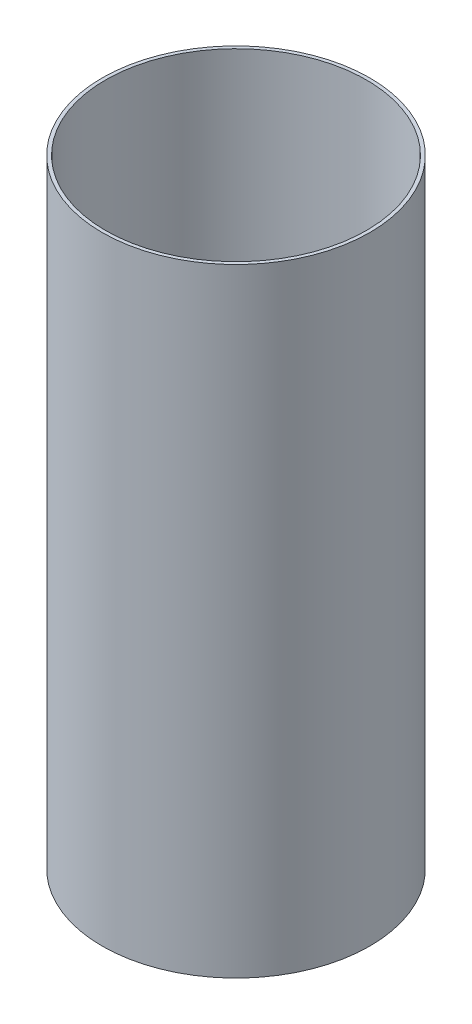
from build123d import *

# Parameters (mm, degrees)
SKETCH1_R           = 49.53
SKETCH1_R_2         = 48.26
BOSS_EXTRUDE1_DEPTH = 228.6


with BuildPart() as part:
    # Sketch1 → Boss-Extrude1 (new body)
    with BuildSketch(Plane(origin=(0, 0, 0), x_dir=(1, 0, 0), z_dir=(0, 1, 0))):
        with Locations(Location((0, 0, 0), (0, 0, 270))):
            Circle(SKETCH1_R)
        with Locations(Location((0, 0, 0), (0, 0, 270))):
            Circle(SKETCH1_R_2, mode=Mode.SUBTRACT)
    extrude(amount=BOSS_EXTRUDE1_DEPTH)


solid = part.part
